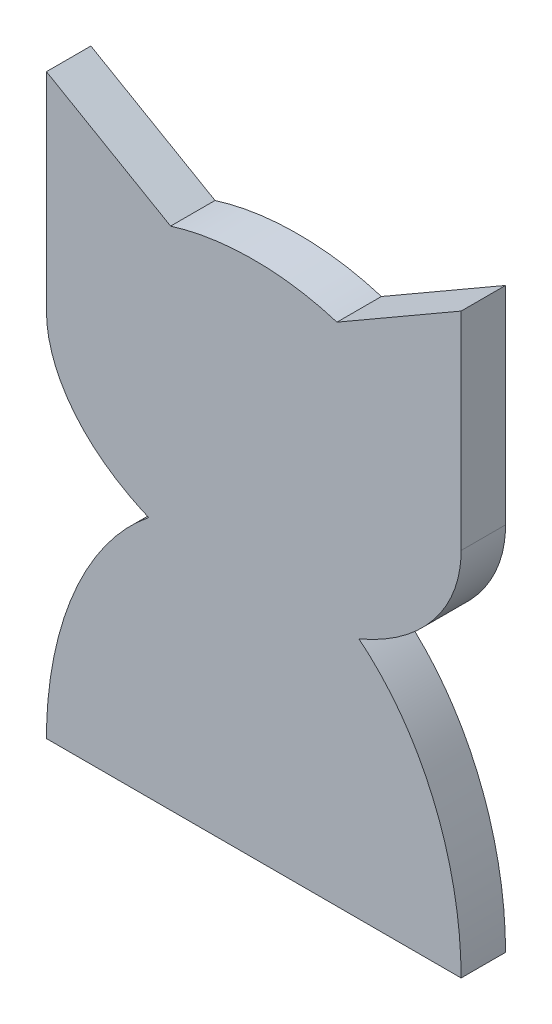
from build123d import *

# Parameters (mm, degrees)
SALIENTE_EXTRUIR2_DEPTH = 3


with BuildPart() as part:
    # Croquis1 → Saliente-Extruir2 (new body)
    with BuildSketch(Plane.XY):
        with BuildLine():
            Line((11, 25), (11, 39))
            Line((11, 39), (19.383258886, 34.159923226))
            add(Edge.make_bspline(
                [(30.616741114, 34.159923226), (25, 35.917122069), (19.383258886, 34.159923226)],
                knots=[4.299567044, 4.299567044, 4.299567044, 5.125210917, 5.125210917, 5.125210917], degree=2, weights=[1, 0.915992323, 1]))
            Line((30.616741114, 34.159923226), (39, 39))
            Line((39, 39), (39, 25))
            add(Edge.make_bspline(
                [(32.095073738, 16.379310345), (39, 19.278775383), (39, 25)],
                knots=[2.102254565, 2.102254565, 2.102254565, 3.141592654, 3.141592654, 3.141592654], degree=2, weights=[1, 0.867983577, 1]))
            add(Edge.make_bspline(
                [(39, 0), (39, 10.870326773), (32.095073738, 16.379310345)],
                knots=[4.71238898, 4.71238898, 4.71238898, 5.751727069, 5.751727069, 5.751727069], degree=2, weights=[1, 0.867983577, 1]))
            Line((39, 0), (11, 0))
            add(Edge.make_bspline(
                [(17.904926262, 16.379310345), (11, 10.870326773), (11, 0)],
                knots=[0.531458238, 0.531458238, 0.531458238, 1.570796327, 1.570796327, 1.570796327], degree=2, weights=[1, 0.867983577, 1]))
            add(Edge.make_bspline(
                [(11, 25), (11, 19.278775383), (17.904926262, 16.379310345)],
                knots=[0, 0, 0, 1.039338089, 1.039338089, 1.039338089], degree=2, weights=[1, 0.867983577, 1]))
        make_face()
    extrude(amount=SALIENTE_EXTRUIR2_DEPTH)


solid = part.part
